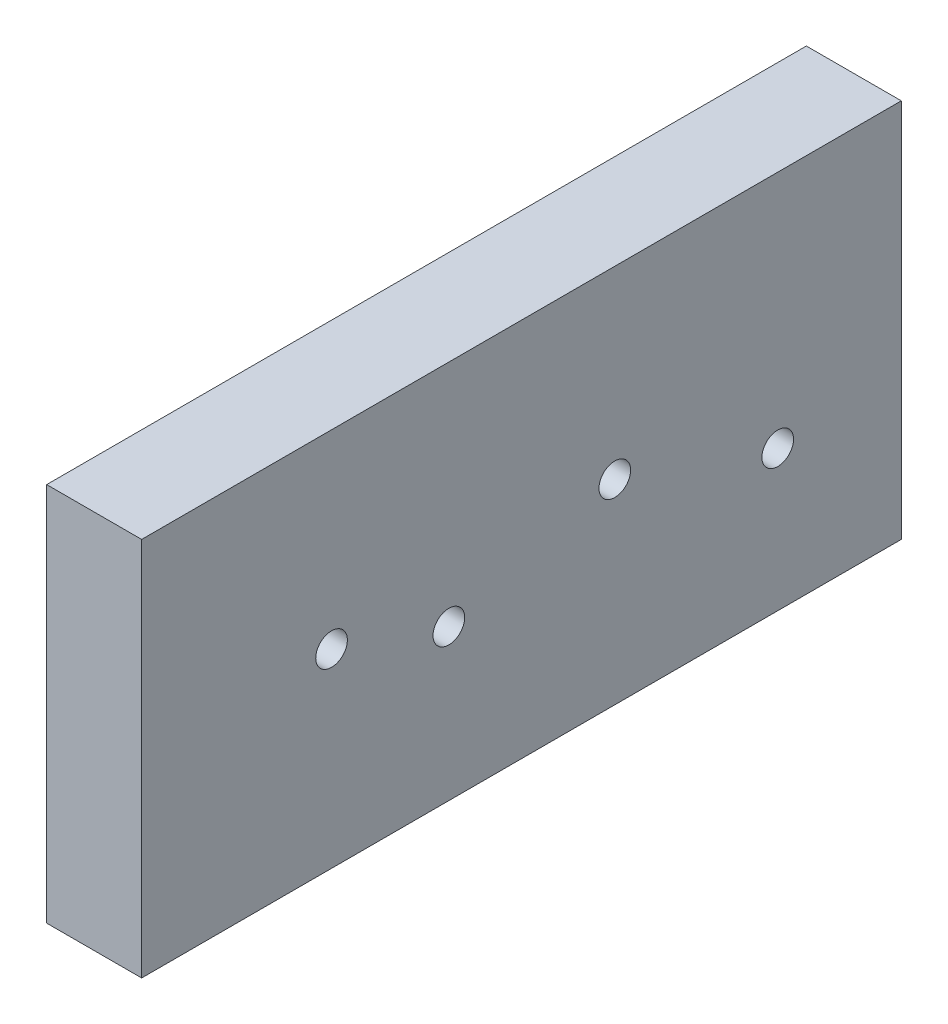
from build123d import *

# Parameters (mm, degrees)
SKETCH1_W                       = 152.4
SKETCH1_H                       = 76.2
SKETCH1_R                       = 3.175
BOSS_EXTRUDE1_DEPTH             = 19.05
SKETCH2_R                       = 4.7625
CUT_EXTRUDE1_DEPTH              = 6.35
F_1_4_0_25_DIAMETER_HOLE1_D     = 6.35
F_1_4_0_25_DIAMETER_HOLE1_DEPTH = 12.7
F_1_4_0_25_DIAMETER_HOLE1_TIP   = 1.907732465


with BuildPart() as part:
    # Sketch1 → Boss-Extrude1 (new body)
    with BuildSketch(Plane(origin=(0, 0, 0), x_dir=(0, 0, -1), z_dir=(1, 0, 0))):
        Rectangle(SKETCH1_W, SKETCH1_H)
        with Locations((18.72253158, 1.096077429)):
            Circle(SKETCH1_R, mode=Mode.SUBTRACT)
        with Locations((-38.1, 0)):
            Circle(SKETCH1_R, mode=Mode.SUBTRACT)
        with Locations((-14.571224015, -7.860160654)):
            Circle(SKETCH1_R, mode=Mode.SUBTRACT)
        with Locations((51.408255992, -9.873506971)):
            Circle(SKETCH1_R, mode=Mode.SUBTRACT)
    extrude(amount=BOSS_EXTRUDE1_DEPTH)

    # Sketch2 → Cut-Extrude1 (cut)
    with BuildSketch(Plane.ZY):
        with Locations((38.1, 0)):
            Circle(SKETCH2_R)
        with Locations((14.571224015, -7.860160654)):
            Circle(SKETCH2_R)
        with Locations((-18.72253158, 1.096077429)):
            Circle(SKETCH2_R)
        with Locations((-51.408255992, -9.873506971)):
            Circle(SKETCH2_R)
    extrude(amount=-CUT_EXTRUDE1_DEPTH, mode=Mode.SUBTRACT)

    # 1/4 (0.25) Diameter Hole1
    with Locations(Plane.XZ.offset(38.1)):
        with Locations((9.525, -63.5), (9.525, 0), (9.525, 57.15)):
            Hole(F_1_4_0_25_DIAMETER_HOLE1_D / 2, depth=F_1_4_0_25_DIAMETER_HOLE1_DEPTH)
            with Locations((0, 0, -(F_1_4_0_25_DIAMETER_HOLE1_DEPTH + F_1_4_0_25_DIAMETER_HOLE1_TIP / 2))):  # 118° drill point
                Cone(0, F_1_4_0_25_DIAMETER_HOLE1_D / 2, F_1_4_0_25_DIAMETER_HOLE1_TIP, mode=Mode.SUBTRACT)


solid = part.part
